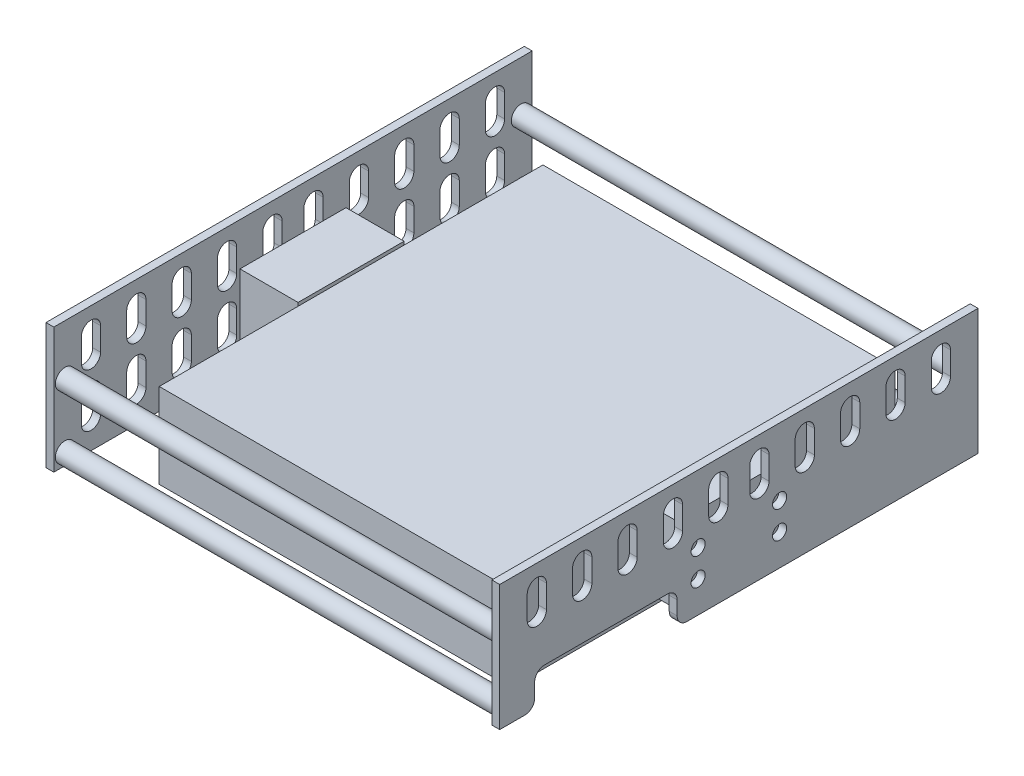
from build123d import *

# Parameters (mm, degrees)
SKETCH1_R               = 2.5019
BOSS_EXTRUDE1_DEPTH     = 115.316
BOSS_EXTRUDE1_2_DEPTH   = 115.316
BOSS_EXTRUDE1_3_DEPTH   = 115.316
BOSS_EXTRUDE1_4_DEPTH   = 115.316
SKETCH5_W               = 123.698
SKETCH5_H               = 32.512
SKETCH5_R               = 1.82245
BOSS_EXTRUDE3_DEPTH     = 2.032
SKETCH6_R               = 1.82245
BOSS_EXTRUDE4_DEPTH     = 2.032
SKETCH7_W               = 27.4193
SKETCH7_H               = 19.7612
BOSS_EXTRUDE5_DEPTH     = 7.239
SKETCH8_W               = 27.4193
SKETCH8_H               = 19.7612
BOSS_EXTRUDE6_DEPTH     = 15.0241
SKETCH9_W               = 91.0209
SKETCH9_H               = 99.2378
BOSS_EXTRUDE7_DEPTH     = 21.9329
CUT_EXTRUDE1_DEPTH      = 2.54
CUT_EXTRUDE1_DEPTH_BACK = 2.54
SKETCH10_R              = 0.508
CUT_EXTRUDE2_DEPTH      = 2.54
CUT_EXTRUDE2_DEPTH_BACK = 2.54
SKETCH11_R              = 0.508


with BuildPart() as part:
    # Sketch1 → Boss-Extrude1 (new body)
    with BuildSketch(Plane(origin=(0, 0, 0), x_dir=(0, 0, -1), z_dir=(1, 0, 0))):
        with Locations(Location((0, 0, 0), (0, 0, 180))):
            Circle(SKETCH1_R)
    extrude(amount=BOSS_EXTRUDE1_DEPTH)



with BuildPart() as body_2:
    # Sketch1 → Boss-Extrude1 2 (new body)
    with BuildSketch(Plane(origin=(0, 0, 0), x_dir=(0, 0, -1), z_dir=(1, 0, 0))):
        with Locations(Location((0, -16.4338, 0), (0, 0, 180))):
            Circle(SKETCH1_R)
    extrude(amount=BOSS_EXTRUDE1_2_DEPTH)


with BuildPart() as body_3:
    # Sketch1 → Boss-Extrude1 3 (new body)
    with BuildSketch(Plane(origin=(0, 0, 0), x_dir=(0, 0, -1), z_dir=(1, 0, 0))):
        with Locations(Location((117.9322, -16.4338, 0), (0, 0, 180))):
            Circle(SKETCH1_R)
    extrude(amount=BOSS_EXTRUDE1_3_DEPTH)


with BuildPart() as body_4:
    # Sketch1 → Boss-Extrude1 4 (new body)
    with BuildSketch(Plane(origin=(0, 0, 0), x_dir=(0, 0, -1), z_dir=(1, 0, 0))):
        with Locations(Location((117.9322, 0, 0), (0, 0, 180))):
            Circle(SKETCH1_R)
    extrude(amount=BOSS_EXTRUDE1_4_DEPTH)


with BuildPart() as part_1:
    add(part.part)

    add(body_2.part)  # Boss-Extrude3 merges body 2

    add(body_3.part)  # Boss-Extrude3 merges body 3

    add(body_4.part)  # Boss-Extrude3 merges body 4
    # Sketch5 → Boss-Extrude3 (add)
    with BuildSketch(Plane(origin=(0, 0, 0), x_dir=(0, 0, -1), z_dir=(1, 0, 0))):
        with Locations((58.9661, -3.302)):
            Rectangle(SKETCH5_W, SKETCH5_H)
        with Locations((48.43145, -4.43865)):
            Circle(SKETCH5_R, mode=Mode.SUBTRACT)
        with Locations((48.43145, -11.49985)):
            Circle(SKETCH5_R, mode=Mode.SUBTRACT)
        with Locations((69.50075, -4.43865)):
            Circle(SKETCH5_R, mode=Mode.SUBTRACT)
        with Locations((69.50075, -11.49985)):
            Circle(SKETCH5_R, mode=Mode.SUBTRACT)
        with BuildLine():
            Line((66.7639, 1.27), (66.7639, 7.2136))
            ThreePointArc((66.7639, 7.2136), (64.2747, 9.7028), (61.7855, 7.2136))
            Line((61.7855, 7.2136), (61.7855, 1.27))
            ThreePointArc((61.7855, 1.27), (64.2747, -1.2192), (66.7639, 1.27))
        make_face(mode=Mode.SUBTRACT)
        with BuildLine():
            Line((66.7639, -12.5095), (66.7639, -6.5659))
            ThreePointArc((66.7639, -6.5659), (64.2747, -4.0767), (61.7855, -6.5659))
            Line((61.7855, -6.5659), (61.7855, -12.5095))
            ThreePointArc((61.7855, -12.5095), (64.2747, -14.9987), (66.7639, -12.5095))
        make_face(mode=Mode.SUBTRACT)
        with BuildLine():
            Line((78.4987, -12.5095), (78.4987, -6.5659))
            ThreePointArc((78.4987, -6.5659), (76.0095, -4.0767), (73.5203, -6.5659))
            Line((73.5203, -6.5659), (73.5203, -12.5095))
            ThreePointArc((73.5203, -12.5095), (76.0095, -14.9987), (78.4987, -12.5095))
        make_face(mode=Mode.SUBTRACT)
        with BuildLine():
            Line((4.2291, 1.27), (4.2291, 7.2136))
            ThreePointArc((4.2291, 7.2136), (6.7183, 9.7028), (9.2075, 7.2136))
            Line((9.2075, 7.2136), (9.2075, 1.27))
            ThreePointArc((9.2075, 1.27), (6.7183, -1.2192), (4.2291, 1.27))
        make_face(mode=Mode.SUBTRACT)
        with BuildLine():
            Line((15.9639, 1.27), (15.9639, 7.2136))
            ThreePointArc((15.9639, 7.2136), (18.4531, 9.7028), (20.9423, 7.2136))
            Line((20.9423, 7.2136), (20.9423, 1.27))
            ThreePointArc((20.9423, 1.27), (18.4531, -1.2192), (15.9639, 1.27))
        make_face(mode=Mode.SUBTRACT)
        with BuildLine():
            Line((27.6987, 1.27), (27.6987, 7.2136))
            ThreePointArc((27.6987, 7.2136), (30.1879, 9.7028), (32.6771, 7.2136))
            Line((32.6771, 7.2136), (32.6771, 1.27))
            ThreePointArc((32.6771, 1.27), (30.1879, -1.2192), (27.6987, 1.27))
        make_face(mode=Mode.SUBTRACT)
        with BuildLine():
            Line((39.4335, 1.27), (39.4335, 7.2136))
            ThreePointArc((39.4335, 7.2136), (41.9227, 9.7028), (44.4119, 7.2136))
            Line((44.4119, 7.2136), (44.4119, 1.27))
            ThreePointArc((44.4119, 1.27), (41.9227, -1.2192), (39.4335, 1.27))
        make_face(mode=Mode.SUBTRACT)
        with BuildLine():
            Line((51.1683, 1.27), (51.1683, 7.2136))
            ThreePointArc((51.1683, 7.2136), (53.6575, 9.7028), (56.1467, 7.2136))
            Line((56.1467, 7.2136), (56.1467, 1.27))
            ThreePointArc((56.1467, 1.27), (53.6575, -1.2192), (51.1683, 1.27))
        make_face(mode=Mode.SUBTRACT)
        with BuildLine():
            Line((15.9639, -12.5095), (15.9639, -6.5659))
            ThreePointArc((15.9639, -6.5659), (18.4531, -4.0767), (20.9423, -6.5659))
            Line((20.9423, -6.5659), (20.9423, -12.5095))
            ThreePointArc((20.9423, -12.5095), (18.4531, -14.9987), (15.9639, -12.5095))
        make_face(mode=Mode.SUBTRACT)
        with BuildLine():
            Line((27.6987, -12.5095), (27.6987, -6.5659))
            ThreePointArc((27.6987, -6.5659), (30.1879, -4.0767), (32.6771, -6.5659))
            Line((32.6771, -6.5659), (32.6771, -12.5095))
            ThreePointArc((32.6771, -12.5095), (30.1879, -14.9987), (27.6987, -12.5095))
        make_face(mode=Mode.SUBTRACT)
        with BuildLine():
            Line((39.4335, -12.5095), (39.4335, -6.5659))
            ThreePointArc((39.4335, -6.5659), (41.9227, -4.0767), (44.4119, -6.5659))
            Line((44.4119, -6.5659), (44.4119, -12.5095))
            ThreePointArc((44.4119, -12.5095), (41.9227, -14.9987), (39.4335, -12.5095))
        make_face(mode=Mode.SUBTRACT)
        with BuildLine():
            Line((51.1683, -12.5095), (51.1683, -6.5659))
            ThreePointArc((51.1683, -6.5659), (53.6575, -4.0767), (56.1467, -6.5659))
            Line((56.1467, -6.5659), (56.1467, -12.5095))
            ThreePointArc((56.1467, -12.5095), (53.6575, -14.9987), (51.1683, -12.5095))
        make_face(mode=Mode.SUBTRACT)
        with BuildLine():
            Line((4.2291, -12.5095), (4.2291, -6.5659))
            ThreePointArc((4.2291, -6.5659), (6.7183, -4.0767), (9.2075, -6.5659))
            Line((9.2075, -6.5659), (9.2075, -12.5095))
            ThreePointArc((9.2075, -12.5095), (6.7183, -14.9987), (4.2291, -12.5095))
        make_face(mode=Mode.SUBTRACT)
        with BuildLine():
            Line((78.4987, 1.27), (78.4987, 7.2136))
            ThreePointArc((78.4987, 7.2136), (76.0095, 9.7028), (73.5203, 7.2136))
            Line((73.5203, 7.2136), (73.5203, 1.27))
            ThreePointArc((73.5203, 1.27), (76.0095, -1.2192), (78.4987, 1.27))
        make_face(mode=Mode.SUBTRACT)
        with BuildLine():
            Line((90.2335, 1.27), (90.2335, 7.2136))
            ThreePointArc((90.2335, 7.2136), (87.7443, 9.7028), (85.2551, 7.2136))
            Line((85.2551, 7.2136), (85.2551, 1.27))
            ThreePointArc((85.2551, 1.27), (87.7443, -1.2192), (90.2335, 1.27))
        make_face(mode=Mode.SUBTRACT)
        with BuildLine():
            Line((90.2335, -12.5095), (90.2335, -6.5659))
            ThreePointArc((90.2335, -6.5659), (87.7443, -4.0767), (85.2551, -6.5659))
            Line((85.2551, -6.5659), (85.2551, -12.5095))
            ThreePointArc((85.2551, -12.5095), (87.7443, -14.9987), (90.2335, -12.5095))
        make_face(mode=Mode.SUBTRACT)
        with BuildLine():
            Line((101.9683, -12.5095), (101.9683, -6.5659))
            ThreePointArc((101.9683, -6.5659), (99.4791, -4.0767), (96.9899, -6.5659))
            Line((96.9899, -6.5659), (96.9899, -12.5095))
            ThreePointArc((96.9899, -12.5095), (99.4791, -14.9987), (101.9683, -12.5095))
        make_face(mode=Mode.SUBTRACT)
        with BuildLine():
            Line((101.9683, 1.27), (101.9683, 7.2136))
            ThreePointArc((101.9683, 7.2136), (99.4791, 9.7028), (96.9899, 7.2136))
            Line((96.9899, 7.2136), (96.9899, 1.27))
            ThreePointArc((96.9899, 1.27), (99.4791, -1.2192), (101.9683, 1.27))
        make_face(mode=Mode.SUBTRACT)
        with BuildLine():
            Line((113.7031, 1.27), (113.7031, 7.2136))
            ThreePointArc((113.7031, 7.2136), (111.2139, 9.7028), (108.7247, 7.2136))
            Line((108.7247, 7.2136), (108.7247, 1.27))
            ThreePointArc((108.7247, 1.27), (111.2139, -1.2192), (113.7031, 1.27))
        make_face(mode=Mode.SUBTRACT)
        with BuildLine():
            Line((113.7031, -12.5095), (113.7031, -6.5659))
            ThreePointArc((113.7031, -6.5659), (111.2139, -4.0767), (108.7247, -6.5659))
            Line((108.7247, -6.5659), (108.7247, -12.5095))
            ThreePointArc((108.7247, -12.5095), (111.2139, -14.9987), (113.7031, -12.5095))
        make_face(mode=Mode.SUBTRACT)
    extrude(amount=BOSS_EXTRUDE3_DEPTH)



with BuildPart() as body_2_2:
    # Sketch6 → Boss-Extrude4 (new body)
    with BuildSketch(Plane(origin=(115.316, 0, 0), x_dir=(0, 0, -1), z_dir=(1, 0, 0))):
        with BuildLine():
            Line((-2.8829, -19.558), (3.6195, -19.558))
            ThreePointArc((3.6195, -19.558), (5.415551224, -18.814051224), (6.1595, -17.018))
            Line((6.1595, -17.018), (6.1595, -13.4112))
            ThreePointArc((6.1595, -13.4112), (6.903448776, -11.615148776), (8.6995, -10.8712))
            Line((8.6995, -10.8712), (40.4495, -10.8712))
            ThreePointArc((40.4495, -10.8712), (42.245551224, -11.615148776), (42.9895, -13.4112))
            Line((42.9895, -13.4112), (42.9895, -17.018))
            ThreePointArc((42.9895, -17.018), (43.733448776, -18.814051224), (45.5295, -19.558))
            Line((45.5295, -19.558), (120.8151, -19.558))
            Line((120.8151, -19.558), (120.8151, 12.954))
            Line((120.8151, 12.954), (-2.8829, 12.954))
            Line((-2.8829, 12.954), (-2.8829, -19.558))
        make_face()
        with Locations((48.43145, -4.43865)):
            Circle(SKETCH6_R, mode=Mode.SUBTRACT)
        with Locations((69.50075, -4.43865)):
            Circle(SKETCH6_R, mode=Mode.SUBTRACT)
        with Locations((69.50075, -11.49985)):
            Circle(SKETCH6_R, mode=Mode.SUBTRACT)
        with Locations((48.43145, -11.49985)):
            Circle(SKETCH6_R, mode=Mode.SUBTRACT)
        with BuildLine():
            Line((15.9639, 7.2136), (15.9639, 1.27))
            ThreePointArc((15.9639, 1.27), (18.4531, -1.2192), (20.9423, 1.27))
            Line((20.9423, 1.27), (20.9423, 7.2136))
            ThreePointArc((20.9423, 7.2136), (18.4531, 9.7028), (15.9639, 7.2136))
        make_face(mode=Mode.SUBTRACT)
        with BuildLine():
            Line((9.2075, 1.27), (9.2075, 7.2136))
            ThreePointArc((9.2075, 7.2136), (6.7183, 9.7028), (4.2291, 7.2136))
            Line((4.2291, 7.2136), (4.2291, 1.27))
            ThreePointArc((4.2291, 1.27), (6.7183, -1.2192), (9.2075, 1.27))
        make_face(mode=Mode.SUBTRACT)
        with BuildLine():
            Line((27.6987, 7.2136), (27.6987, 1.27))
            ThreePointArc((27.6987, 1.27), (30.1879, -1.2192), (32.6771, 1.27))
            Line((32.6771, 1.27), (32.6771, 7.2136))
            ThreePointArc((32.6771, 7.2136), (30.1879, 9.7028), (27.6987, 7.2136))
        make_face(mode=Mode.SUBTRACT)
        with BuildLine():
            Line((39.4335, 7.2136), (39.4335, 1.27))
            ThreePointArc((39.4335, 1.27), (41.9227, -1.2192), (44.4119, 1.27))
            Line((44.4119, 1.27), (44.4119, 7.2136))
            ThreePointArc((44.4119, 7.2136), (41.9227, 9.7028), (39.4335, 7.2136))
        make_face(mode=Mode.SUBTRACT)
        with BuildLine():
            Line((51.1683, 7.2136), (51.1683, 1.27))
            ThreePointArc((51.1683, 1.27), (53.6575, -1.2192), (56.1467, 1.27))
            Line((56.1467, 1.27), (56.1467, 7.2136))
            ThreePointArc((56.1467, 7.2136), (53.6575, 9.7028), (51.1683, 7.2136))
        make_face(mode=Mode.SUBTRACT)
        with BuildLine():
            Line((61.7855, 1.27), (61.7855, 7.2136))
            ThreePointArc((61.7855, 7.2136), (64.2747, 9.7028), (66.7639, 7.2136))
            Line((66.7639, 7.2136), (66.7639, 1.27))
            ThreePointArc((66.7639, 1.27), (64.2747, -1.2192), (61.7855, 1.27))
        make_face(mode=Mode.SUBTRACT)
        with BuildLine():
            Line((73.5203, 1.27), (73.5203, 7.2136))
            ThreePointArc((73.5203, 7.2136), (76.0095, 9.7028), (78.4987, 7.2136))
            Line((78.4987, 7.2136), (78.4987, 1.27))
            ThreePointArc((78.4987, 1.27), (76.0095, -1.2192), (73.5203, 1.27))
        make_face(mode=Mode.SUBTRACT)
        with BuildLine():
            Line((85.2551, 1.27), (85.2551, 7.2136))
            ThreePointArc((85.2551, 7.2136), (87.7443, 9.7028), (90.2335, 7.2136))
            Line((90.2335, 7.2136), (90.2335, 1.27))
            ThreePointArc((90.2335, 1.27), (87.7443, -1.2192), (85.2551, 1.27))
        make_face(mode=Mode.SUBTRACT)
        with BuildLine():
            Line((96.9899, 1.27), (96.9899, 7.2136))
            ThreePointArc((96.9899, 7.2136), (99.4791, 9.7028), (101.9683, 7.2136))
            Line((101.9683, 7.2136), (101.9683, 1.27))
            ThreePointArc((101.9683, 1.27), (99.4791, -1.2192), (96.9899, 1.27))
        make_face(mode=Mode.SUBTRACT)
        with BuildLine():
            Line((113.7031, 7.2136), (113.7031, 1.27))
            ThreePointArc((113.7031, 1.27), (111.2139, -1.2192), (108.7247, 1.27))
            Line((108.7247, 1.27), (108.7247, 7.2136))
            ThreePointArc((108.7247, 7.2136), (111.2139, 9.7028), (113.7031, 7.2136))
        make_face(mode=Mode.SUBTRACT)
    extrude(amount=BOSS_EXTRUDE4_DEPTH)


with BuildPart() as part_2:
    add(part_1.part)

    add(body_2_2.part)  # Boss-Extrude5 merges body 2 2
    # Sketch7 → Boss-Extrude5 (add)
    with BuildSketch(Plane.ZY.offset(-115.316)):
        with Locations((-58.9661, -7.96925)):
            Rectangle(SKETCH7_W, SKETCH7_H)
    extrude(amount=BOSS_EXTRUDE5_DEPTH)

    # Sketch8 → Boss-Extrude6 (add)
    with BuildSketch(Plane(origin=(2.032, 0, 0), x_dir=(0, 0, -1), z_dir=(1, 0, 0))):
        with Locations((58.9661, -7.96925)):
            Rectangle(SKETCH8_W, SKETCH8_H)
    extrude(amount=BOSS_EXTRUDE6_DEPTH)


with BuildPart() as body_2_3:
    # Sketch9 → Boss-Extrude7 (new body)
    with BuildSketch(Plane(origin=(0, -20.8915, 0), x_dir=(-1, 0, 0), z_dir=(0, -1, 0))):
        with Locations((-62.56655, 58.9661)):
            Rectangle(SKETCH9_W, SKETCH9_H)
    extrude(amount=-BOSS_EXTRUDE7_DEPTH)


with BuildPart() as cut_extrude1_tool:
    # Sketch10 → Cut-Extrude1 (new, two sides: drawn at the far end of the back side and taken through both)
    with BuildSketch(Plane.ZY.offset(-17.0561).offset(-CUT_EXTRUDE1_DEPTH_BACK)):
        with Locations((-58.9661, -9.92505)):
            Circle(SKETCH10_R)
    extrude(amount=CUT_EXTRUDE1_DEPTH + CUT_EXTRUDE1_DEPTH_BACK)


with BuildPart() as part_3:
    add(part_2.part)

    # Cut-Extrude1: cut by cut_extrude1_tool
    add(cut_extrude1_tool.part, mode=Mode.SUBTRACT)


with BuildPart() as body_2_3_1:
    add(body_2_3.part)

    # Cut-Extrude1: cut by cut_extrude1_tool
    add(cut_extrude1_tool.part, mode=Mode.SUBTRACT)


with BuildPart() as cut_extrude2_tool:
    # Sketch11 → Cut-Extrude2 (new, two sides: drawn at the far end of the back side and taken through both)
    with BuildSketch(Plane(origin=(108.077, 0, 0), x_dir=(0, 0, -1), z_dir=(1, 0, 0)).offset(-CUT_EXTRUDE2_DEPTH_BACK)):
        with Locations(Location((58.9661, -9.92505, 0), (0, 0, 180))):
            Circle(SKETCH11_R)
    extrude(amount=CUT_EXTRUDE2_DEPTH + CUT_EXTRUDE2_DEPTH_BACK)


with BuildPart() as part_4:
    add(part_3.part)

    # Cut-Extrude2: cut by cut_extrude2_tool
    add(cut_extrude2_tool.part, mode=Mode.SUBTRACT)


with BuildPart() as body_2_3_2:
    add(body_2_3_1.part)

    # Cut-Extrude2: cut by cut_extrude2_tool
    add(cut_extrude2_tool.part, mode=Mode.SUBTRACT)


solid = Compound([part_4.part, body_2_3_2.part])
